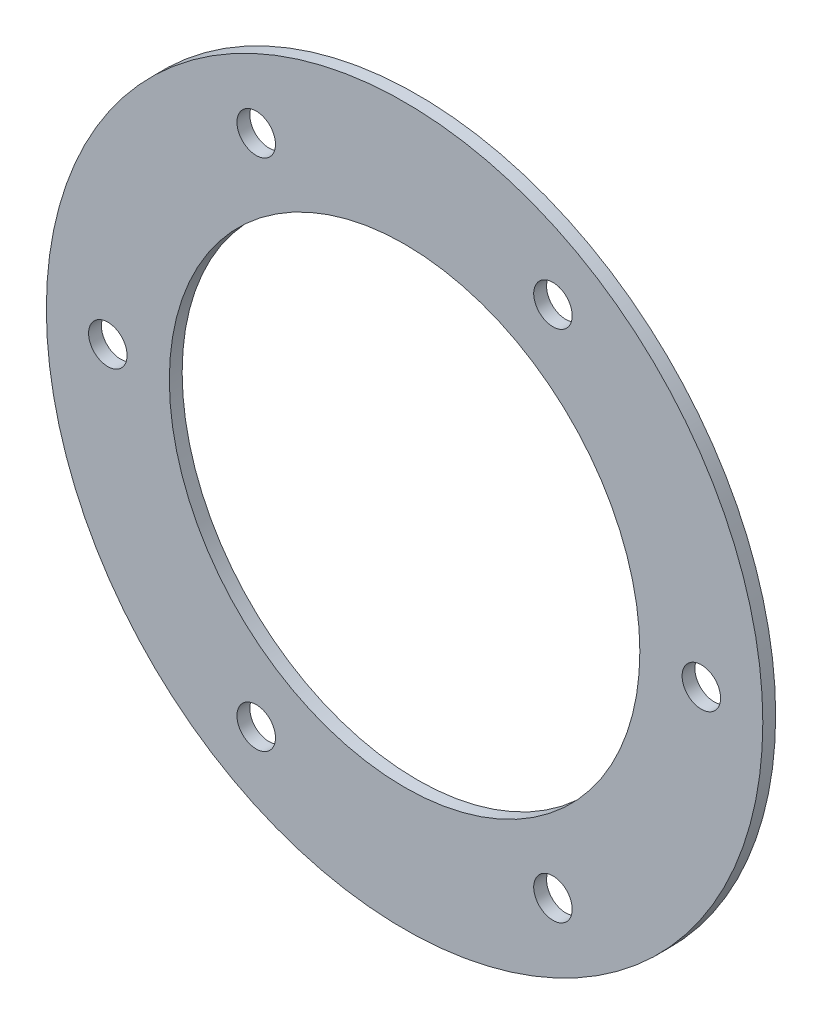
from build123d import *

# Parameters (mm, degrees)
SKETCH_1_R          = 167.5
SKETCH_1_R_2        = 110
EXTRUDE_1_DEPTH     = 6
SKETCH_2_R          = 9
CUT_EXTRUDE_1_DEPTH = 237.956747108


with BuildPart() as part:
    # Эскиз1 → Бобышка-Вытянуть1 (new body)
    with BuildSketch(Plane.XY):
        Circle(SKETCH_1_R)
        Circle(SKETCH_1_R_2, mode=Mode.SUBTRACT)
    extrude(amount=EXTRUDE_1_DEPTH)

    # Эскиз2 → Вырез-Вытянуть1 (cut, through all)
    with BuildSketch(Plane.XY.offset(6)):
        with Locations((-69.375, 120.161024775)):
            Circle(SKETCH_2_R)
        with Locations((69.375, 120.161024775)):
            Circle(SKETCH_2_R)
        with Locations((138.75, 0)):
            Circle(SKETCH_2_R)
        with Locations((69.375, -120.161024775)):
            Circle(SKETCH_2_R)
        with Locations((-69.375, -120.161024775)):
            Circle(SKETCH_2_R)
        with Locations((-138.75, 0)):
            Circle(SKETCH_2_R)
    extrude(amount=-CUT_EXTRUDE_1_DEPTH, mode=Mode.SUBTRACT)


solid = part.part
